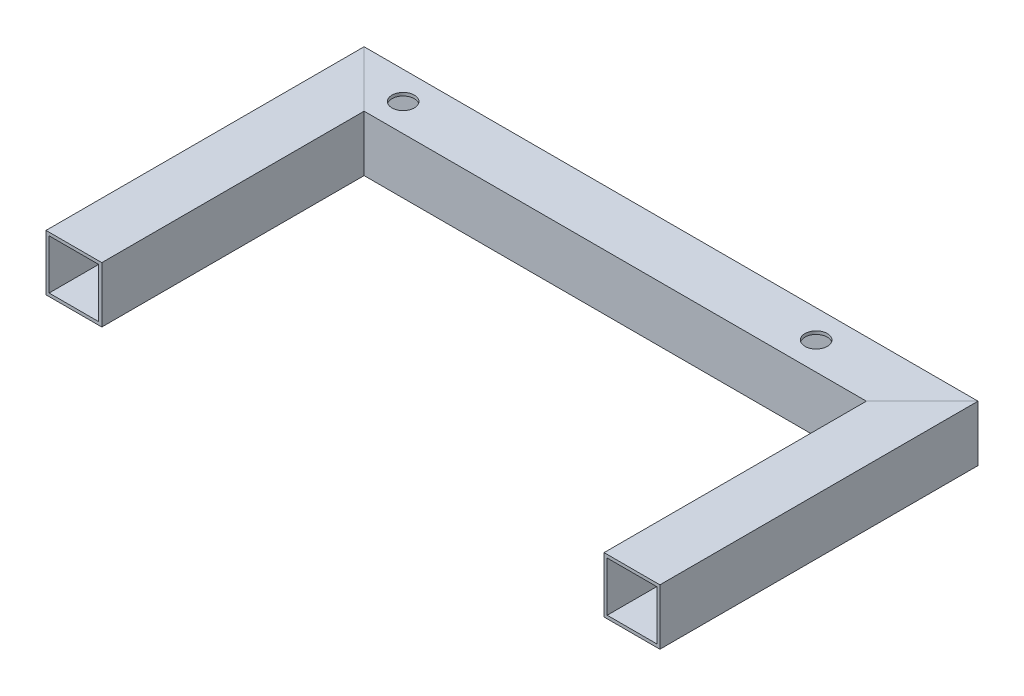
from build123d import *

# Parameters (mm, degrees)
SKETCH2_W          = 25
SKETCH2_H          = 25
SKETCH2_W_2        = 22.2
SKETCH2_H_2        = 22.2
CUT_EXTRUDE1_REACH = 192.87
SKETCH3_R          = 5


with BuildPart() as part:
    # Sweep1: sweep along a path in Sketch1
    with BuildLine(Plane(origin=(0, 0, 0), x_dir=(1, 0, 0), z_dir=(0, 1, 0))) as sweep1_path:
        Line((-125, -130), (-125, 0))
        Line((-125, 0), (125, 0))
        Line((125, 0), (125, -130))
    # Sketch2 → Sweep1 (sweep)
    with BuildSketch(Plane(origin=(-125, 0, 130), x_dir=(-1, 0, 0), z_dir=(0, 0, -1))):
        Rectangle(SKETCH2_W, SKETCH2_H)
        Rectangle(SKETCH2_W_2, SKETCH2_H_2, mode=Mode.SUBTRACT)
    sweep(path=sweep1_path.line, transition=Transition.RIGHT)

    # Cut-Extrude1: up to this face of the body (flat: up to its plane)
    cut_extrude1_end = Plane(part.part.faces().sort_by_distance((-115.59727703, -12.5, 71.25))[0])
    # Sketch3 → Cut-Extrude1 (cut, up to the picked face)
    with BuildSketch(Plane(origin=(0, 12.5, 0), x_dir=(1, 0, 0), z_dir=(0, 1, 0)), mode=Mode.PRIVATE) as cut_extrude1_sk1:
        with Locations(Location((77.5, 0, 0), (0, 0, 270))):
            Circle(SKETCH3_R)
    cut_extrude1_tool1 = split(extrude(cut_extrude1_sk1.sketch, amount=-CUT_EXTRUDE1_REACH, mode=Mode.PRIVATE), bisect_by=cut_extrude1_end, keep=Keep.BOTH, mode=Mode.PRIVATE)
    # Sketch3 → Cut-Extrude1 (cut, up to the picked face)
    with BuildSketch(Plane(origin=(0, 12.5, 0), x_dir=(1, 0, 0), z_dir=(0, 1, 0)), mode=Mode.PRIVATE) as cut_extrude1_sk2:
        with Locations(Location((-107.5, 0, 0), (0, 0, 270))):
            Circle(SKETCH3_R)
    cut_extrude1_tool2 = split(extrude(cut_extrude1_sk2.sketch, amount=-CUT_EXTRUDE1_REACH, mode=Mode.PRIVATE), bisect_by=cut_extrude1_end, keep=Keep.BOTH, mode=Mode.PRIVATE)
    add(cut_extrude1_tool1.solids().sort_by(Axis((77.5, 12.5, 0), (0, -1, 0)))[0], mode=Mode.SUBTRACT)
    add(cut_extrude1_tool2.solids().sort_by(Axis((-107.5, 12.5, 0), (0, -1, 0)))[0], mode=Mode.SUBTRACT)


solid = part.part
